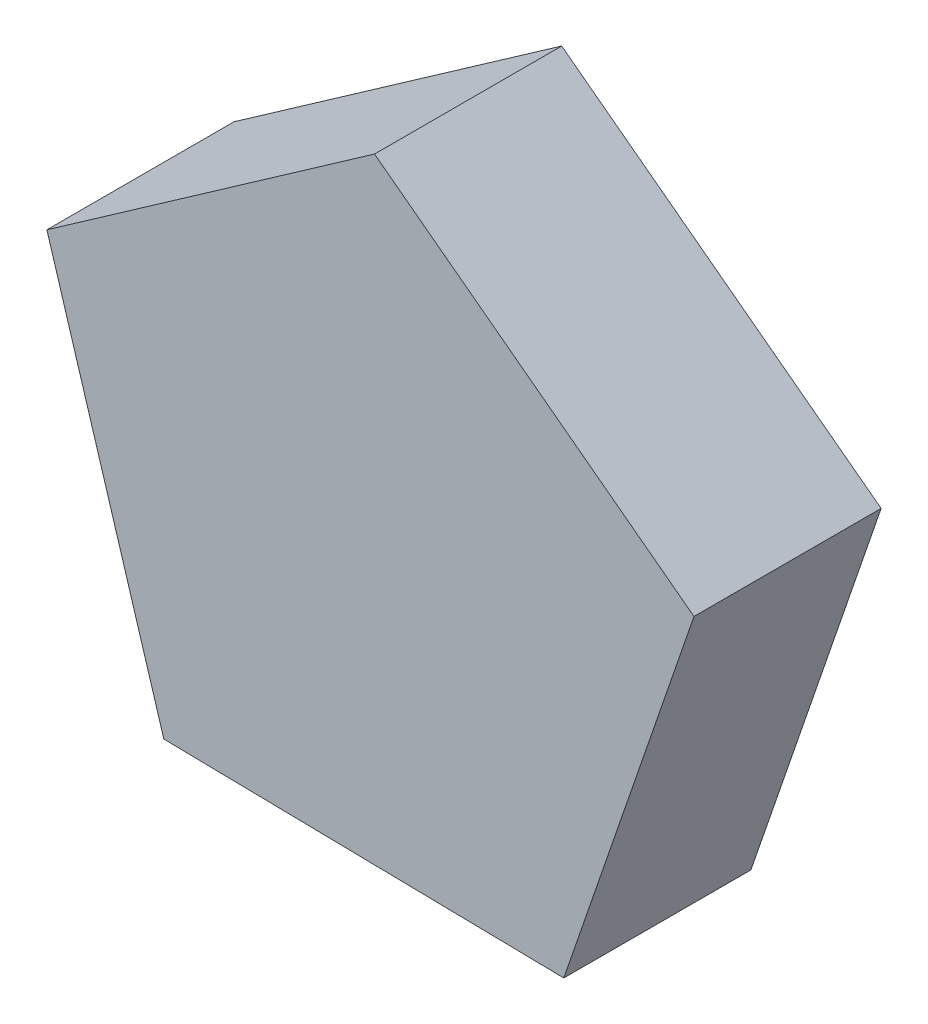
from build123d import *

# Parameters (mm, degrees)
BOSS_EXTRUDE1_DEPTH = 11


with BuildPart() as part:
    # Sketch1 → Boss-Extrude1 (new body)
    with BuildSketch(Plane.XY):
        Polygon((31.126095119, 22.847434094), (12.349048129, 36.996953903), (-6.910371512, 23.511363089), (-0.036300463, 1.027289799), (23.471528727, 0.616959114), align=None)
    extrude(amount=BOSS_EXTRUDE1_DEPTH)


solid = part.part
